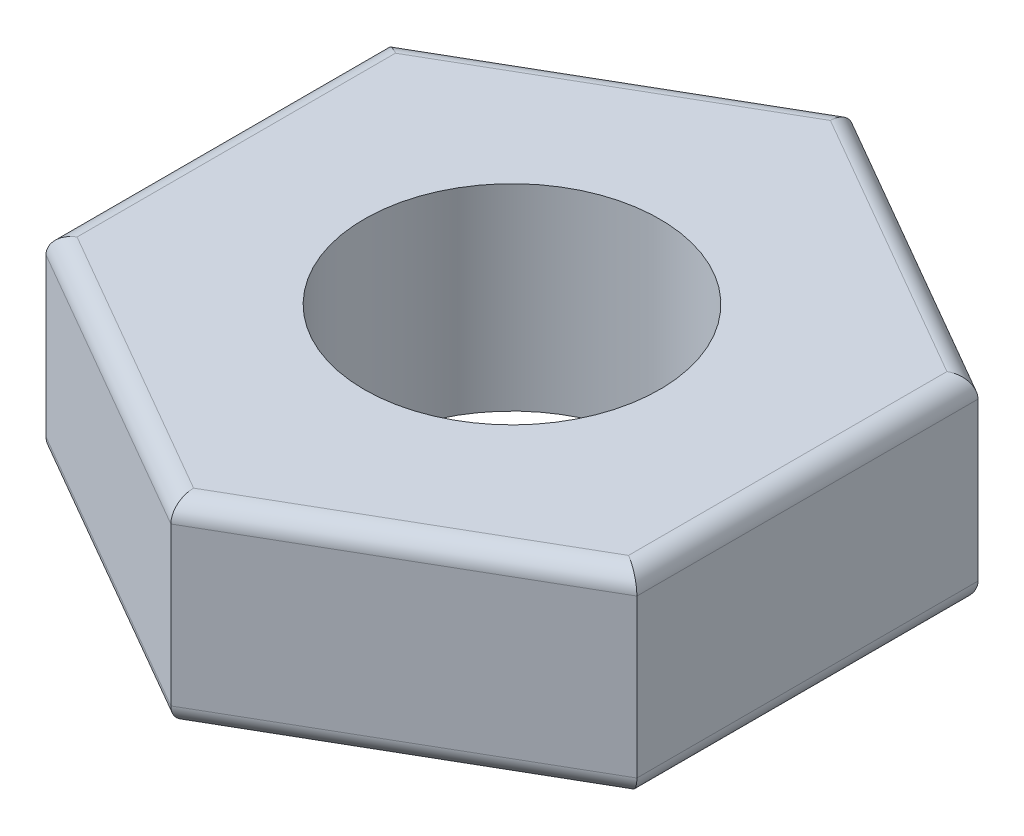
from build123d import *

# Parameters (mm, degrees)
SKETCH1_R           = 3
BOSS_EXTRUDE1_DEPTH = 4
FILLET1_R           = 0.4


with BuildPart() as part:
    # Sketch1 → Boss-Extrude1 (new body)
    with BuildSketch(Plane(origin=(0, 0, 0), x_dir=(1, 0, 0), z_dir=(0, 1, 0))):
        Polygon((0, 6.92820323), (-6, 3.464101615), (-6, -3.464101615), (0, -6.92820323), (6, -3.464101615), (6, 3.464101615), align=None)
        with Locations(Location((0, 0, 0), (0, 0, 270))):
            Circle(SKETCH1_R, mode=Mode.SUBTRACT)
    extrude(amount=BOSS_EXTRUDE1_DEPTH)

    # Fillet1
    fillet1_edges = [part.edges().sort_by_distance(p)[0] for p in [
        (-6, 4, 0),
        (-3, 4, 5.196152423),
        (3, 4, 5.196152423),
        (6, 4, 0),
        (3, 4, -5.196152423),
        (6, 0, 0),
        (3, 0, 5.196152423),
        (-3, 0, 5.196152423),
        (-6, 0, 0),
        (-3, 0, -5.196152423),
        (3, 0, -5.196152423),
        (-3, 4, -5.196152423),
    ]]
    fillet(fillet1_edges, radius=FILLET1_R)


solid = part.part
